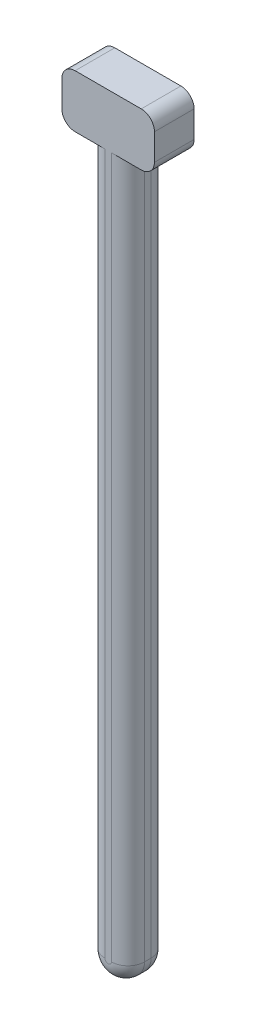
from build123d import *

# Parameters (mm, degrees)
BOSS_EXTRUDE1_DEPTH = 3
FILLET1_R           = 1.25
FILLET2_R           = 1


with BuildPart() as part:
    # Sketch1 → Boss-Extrude1 (new body)
    with BuildSketch(Plane.XY):
        with BuildLine():
            Line((-3.5, 2), (-3.5, -2))
            Line((-3.5, -2), (-1.5, -2))
            Line((-1.5, -2), (-1.5, -55))
            ThreePointArc((-1.5, -55), (0, -56.5), (1.5, -55))
            Line((1.5, -55), (1.5, -2))
            Line((1.5, -2), (3.5, -2))
            Line((3.5, -2), (3.5, 2))
            Line((3.5, 2), (-3.5, 2))
        make_face()
    extrude(amount=BOSS_EXTRUDE1_DEPTH)

    # Fillet1
    fillet1_edges = [part.edges().sort_by_distance(p)[0] for p in [
        (-1.5, -28.5, 0),
        (0, -56.5, 0),
        (-1.5, -28.5, 3),
        (0, -56.5, 3),
        (1.5, -28.5, 0),
        (1.5, -28.5, 3),
    ]]
    fillet(fillet1_edges, radius=FILLET1_R)

    # Fillet2
    fillet2_edges = [part.edges().sort_by_distance(p)[0] for p in [
        (-3.5, -2, 1.5),
        (3.5, -2, 1.5),
        (3.5, 2, 1.5),
        (-3.5, 2, 1.5),
    ]]
    fillet(fillet2_edges, radius=FILLET2_R)


solid = part.part
